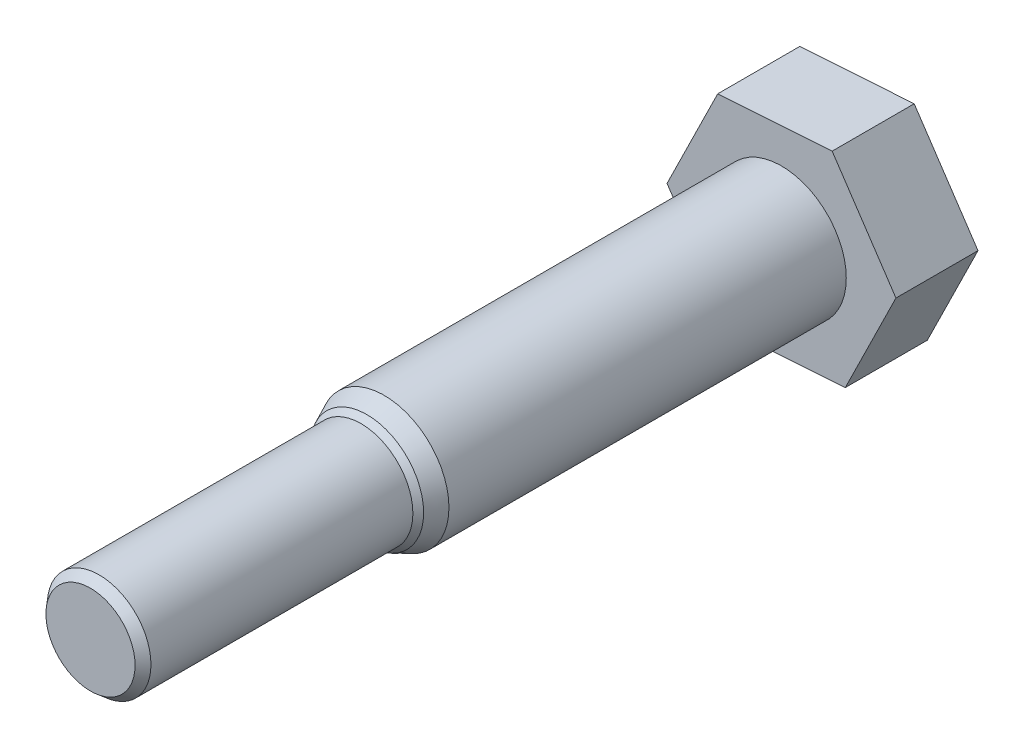
from build123d import *

# Parameters (mm, degrees)
SKETCH_1_R       = 15
EXTRUDE_1_DEPTH  = 111
EXTRUDE_2_DEPTH  = 19
SKETCH_7_R       = 15
EXTRUDE_4_DEPTH  = 4
EXTRUDE_4_TAPER  = 25
SKETCH_22_R      = 12
EXTRUDE_22_DEPTH = 62
SKETCH_23_R      = 13.134769367
EXTRUDE_24_DEPTH = 2
EXTRUDE_24_TAPER = 40
SKETCH_24_R      = 12
EXTRUDE_25_DEPTH = 2
EXTRUDE_25_TAPER = 40


with BuildPart() as part:
    # 草图1 → 拉伸1 (new body)
    with BuildSketch(Plane.XY):
        Circle(SKETCH_1_R)
    extrude(amount=EXTRUDE_1_DEPTH)

    # 草图2 → 拉伸2 (add)
    with BuildSketch(Plane.XY):
        Polygon((14.770690633, -22.071702054), (26.5, 1.755942292), (11.729309367, 23.827644346), (-14.770690633, 22.071702054), (-26.5, -1.755942292), (-11.729309367, -23.827644346), align=None)
    extrude(amount=EXTRUDE_2_DEPTH)

    # 草图7 → 拉伸4 (add)
    with BuildSketch(Plane.XY.offset(111)):
        Circle(SKETCH_7_R)
    extrude(amount=EXTRUDE_4_DEPTH, taper=EXTRUDE_4_TAPER)

    # 草图22 → 拉伸22 (add)
    with BuildSketch(Plane.XY.offset(115)):
        Circle(SKETCH_22_R)
    extrude(amount=EXTRUDE_22_DEPTH)

    # 草图23 → 拉伸24 (add)
    with BuildSketch(Plane.XY.offset(115)):
        Circle(SKETCH_23_R)
    extrude(amount=EXTRUDE_24_DEPTH, taper=EXTRUDE_24_TAPER)

    # 草图24 → 拉伸25 (add)
    with BuildSketch(Plane.XY.offset(177)):
        Circle(SKETCH_24_R)
    extrude(amount=EXTRUDE_25_DEPTH, taper=EXTRUDE_25_TAPER)


solid = part.part
